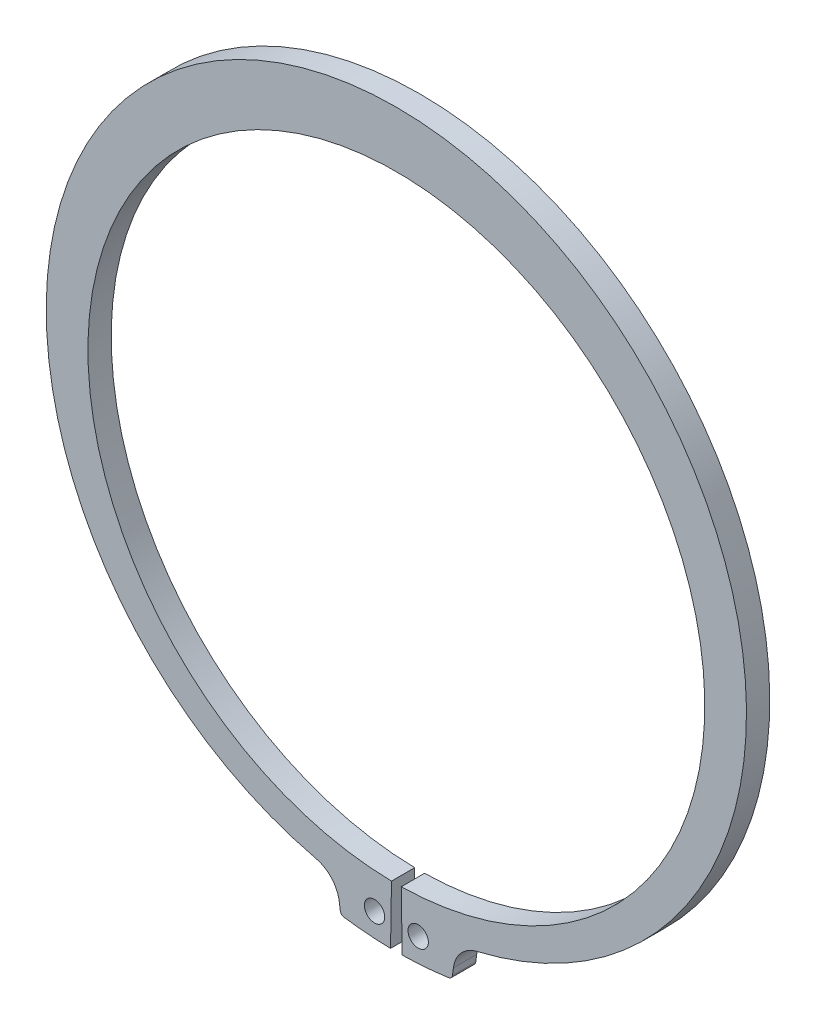
from build123d import *

# Parameters (mm, degrees)
BODYSKE_R  = 1.75
BODY_DEPTH = 4


with BuildPart() as part:
    # BodySke → Body (new body)
    with BuildSketch(Plane.XY):
        with BuildLine():
            Line((0.839936609, -52.993343983), (1, -63.092075572))
            ThreePointArc((1, -63.092075572), (5.010845559, -62.900726759), (9.001399741, -62.454661977))
            ThreePointArc((9.001399741, -62.454661977), (9.427976207, -62.239406539), (9.637993691, -61.810227042))
            Line((9.637993691, -61.810227042), (9.799126964, -60.586298321))
            ThreePointArc((9.799126964, -60.586298321), (11.121448183, -57.724736041), (13.834905808, -56.120298506))
            ThreePointArc((13.834905808, -56.120298506), (0, 62.6), (-13.834905808, -56.120298506))
            ThreePointArc((-13.834905808, -56.120298506), (-11.121448183, -57.724736041), (-9.799126964, -60.586298321))
            Line((-9.799126964, -60.586298321), (-9.637993691, -61.810227042))
            ThreePointArc((-9.637993691, -61.810227042), (-9.427976207, -62.239406539), (-9.001399741, -62.454661977))
            ThreePointArc((-9.001399741, -62.454661977), (-5.010845559, -62.900726759), (-1, -63.092075572))
            Line((-1, -63.092075572), (-0.839936609, -52.993343983))
            ThreePointArc((-0.839936609, -52.993343983), (0, 53), (0.839936609, -52.993343983))
        make_face()
        with Locations((3.75, -58.930806884)):
            Circle(BODYSKE_R, mode=Mode.SUBTRACT)
        with Locations((-3.75, -58.930806884)):
            Circle(BODYSKE_R, mode=Mode.SUBTRACT)
    extrude(amount=-BODY_DEPTH)


solid = part.part
